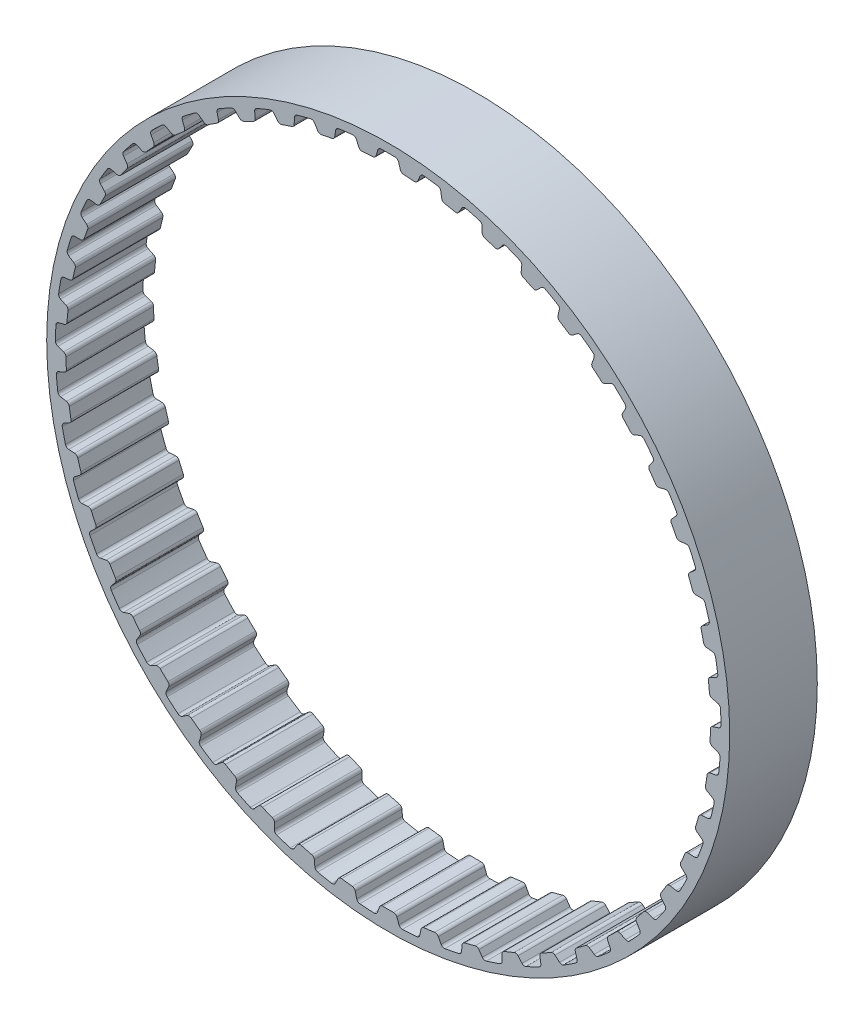
from build123d import *

# Parameters (mm, degrees)
SKETCH1_R           = 38.992993993
SKETCH1_R_2         = 36.792993993
BOSS_EXTRUDE1_DEPTH = 5
CUT_EXTRUDE1_DEPTH  = 5
CIRPATTERN1_COUNT   = 49


with BuildPart() as part:
    # Sketch1 → Boss-Extrude1 (new, symmetric)
    with BuildSketch(Plane.XY):
        Circle(SKETCH1_R)
        Circle(SKETCH1_R_2, mode=Mode.SUBTRACT)
    extrude(amount=BOSS_EXTRUDE1_DEPTH, both=True)

    # Sketch3 → Cut-Extrude1 (cut, symmetric)
    with BuildSketch(Plane.XY):
        with BuildLine():
            Line((-1.747444301, 36.751474058), (1.747444301, 36.751474058))
            ThreePointArc((1.747444301, 36.751474058), (1.519090326, 36.83667062), (1.382571786, 37.038578223))
            Line((1.382571786, 37.038578223), (1.189763567, 37.696799343))
            ThreePointArc((1.189763567, 37.696799343), (1.049126099, 37.901904722), (0.814468408, 37.984262976))
            ThreePointArc((0.814468408, 37.984262976), (0, 37.992993993), (-0.814468408, 37.984262976))
            ThreePointArc((-0.814468408, 37.984262976), (-1.049126099, 37.901904722), (-1.189763567, 37.696799343))
            Line((-1.189763567, 37.696799343), (-1.382571786, 37.038578223))
            ThreePointArc((-1.382571786, 37.038578223), (-1.519090326, 36.83667062), (-1.747444301, 36.751474058))
        make_face()
    cut_extrude1 = extrude(amount=CUT_EXTRUDE1_DEPTH, both=True, mode=Mode.SUBTRACT)

    # CirPattern1: Cut-Extrude1 ×49 about axis
    cirpattern1_axis = Axis((0, 0, 0), (0, 0, 1))
    for i in range(1, CIRPATTERN1_COUNT):
        add(cut_extrude1.rotate(cirpattern1_axis, i * 360 / CIRPATTERN1_COUNT), mode=Mode.SUBTRACT)


solid = part.part
